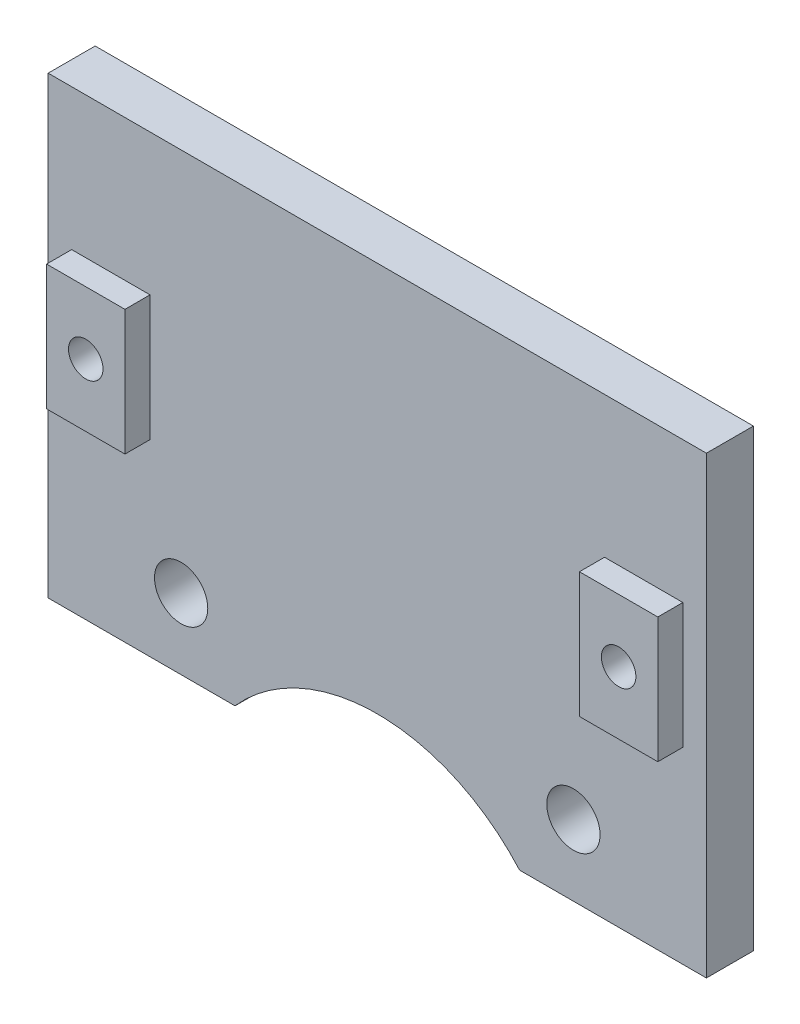
from build123d import *

# Parameters (mm, degrees)
MOUNTING_PLATE_SKETCH_W        = 42
MOUNTING_PLATE_SKETCH_H        = 29
MOUNTING_PLATE_DEPTH           = 3
AXLE_COLLAR_CLEARANCE_SKETCH_R = 12.1
AXLE_COLLAR_CLEARANCE_DEPTH    = 3.2
M3_CAP_BOLT_HOLE_1_SKETCH_R    = 1.7
M3_CAP_BOLT_HOLE_1_DEPTH       = 3.2
M3_CAP_BOLT_HOLE_2_SKETCH_R    = 1.7
M3_CAP_BOLT_HOLE_2_DEPTH       = 3.2
CLAMP_SEAT_1_SKETCH_W          = 5
CLAMP_SEAT_1_SKETCH_H          = 8
CLAMP_SEAT_1_DEPTH             = 1.7
M2_SCREW_CLEARANCE_1_SKETCH_R  = 1.1
M2_SCREW_CLEARANCE_1_DEPTH     = 4.8
M2_INSERT_POCKET_1_SKETCH_R    = 1.6
M2_INSERT_POCKET_1_DEPTH       = 2.5
CLAMP_SEAT_2_SKETCH_W          = 5
CLAMP_SEAT_2_SKETCH_H          = 8
CLAMP_SEAT_2_DEPTH             = 1.7
M2_SCREW_CLEARANCE_2_SKETCH_R  = 1.1
M2_SCREW_CLEARANCE_2_DEPTH     = 4.8
M2_INSERT_POCKET_2_SKETCH_R    = 1.6
M2_INSERT_POCKET_2_DEPTH       = 2.5


with BuildPart() as part:
    # Mounting Plate Sketch → Mounting Plate (new body)
    with BuildSketch(Plane.XY):
        with Locations((0, -1.5)):
            Rectangle(MOUNTING_PLATE_SKETCH_W, MOUNTING_PLATE_SKETCH_H)
    extrude(amount=MOUNTING_PLATE_DEPTH)

    # Axle Collar Clearance Sketch → Axle Collar Clearance (cut)
    with BuildSketch(Plane.XY.offset(-0.1)):
        with Locations((0, -24)):
            Circle(AXLE_COLLAR_CLEARANCE_SKETCH_R)
    extrude(amount=AXLE_COLLAR_CLEARANCE_DEPTH, mode=Mode.SUBTRACT)

    # M3 Cap Bolt Hole 1 Sketch → M3 Cap Bolt Hole 1 (cut)
    with BuildSketch(Plane.XY.offset(-0.1)):
        with Locations((-12.515790027, -11.484209973)):
            Circle(M3_CAP_BOLT_HOLE_1_SKETCH_R)
    extrude(amount=M3_CAP_BOLT_HOLE_1_DEPTH, mode=Mode.SUBTRACT)

    # M3 Cap Bolt Hole 2 Sketch → M3 Cap Bolt Hole 2 (cut)
    with BuildSketch(Plane.XY.offset(-0.1)):
        with Locations((12.515790027, -11.484209973)):
            Circle(M3_CAP_BOLT_HOLE_2_SKETCH_R)
    extrude(amount=M3_CAP_BOLT_HOLE_2_DEPTH, mode=Mode.SUBTRACT)

    # Clamp Seat 1 Sketch → Clamp Seat 1 (add)
    with BuildSketch(Plane.XY.offset(2.9)):
        with Locations((-17, 0)):
            Rectangle(CLAMP_SEAT_1_SKETCH_W, CLAMP_SEAT_1_SKETCH_H)
    extrude(amount=CLAMP_SEAT_1_DEPTH)

    # M2 Screw Clearance 1 Sketch → M2 Screw Clearance 1 (cut)
    with BuildSketch(Plane.XY.offset(-0.1)):
        with Locations((-17, 0)):
            Circle(M2_SCREW_CLEARANCE_1_SKETCH_R)
    extrude(amount=M2_SCREW_CLEARANCE_1_DEPTH, mode=Mode.SUBTRACT)

    # M2 Insert Pocket 1 Sketch → M2 Insert Pocket 1 (cut)
    with BuildSketch(Plane.XY.offset(-0.1)):
        with Locations((-17, 0)):
            Circle(M2_INSERT_POCKET_1_SKETCH_R)
    extrude(amount=M2_INSERT_POCKET_1_DEPTH, mode=Mode.SUBTRACT)

    # Clamp Seat 2 Sketch → Clamp Seat 2 (add)
    with BuildSketch(Plane.XY.offset(2.9)):
        with Locations((17, 0)):
            Rectangle(CLAMP_SEAT_2_SKETCH_W, CLAMP_SEAT_2_SKETCH_H)
    extrude(amount=CLAMP_SEAT_2_DEPTH)

    # M2 Screw Clearance 2 Sketch → M2 Screw Clearance 2 (cut)
    with BuildSketch(Plane.XY.offset(-0.1)):
        with Locations((17, 0)):
            Circle(M2_SCREW_CLEARANCE_2_SKETCH_R)
    extrude(amount=M2_SCREW_CLEARANCE_2_DEPTH, mode=Mode.SUBTRACT)

    # M2 Insert Pocket 2 Sketch → M2 Insert Pocket 2 (cut)
    with BuildSketch(Plane.XY.offset(-0.1)):
        with Locations((17, 0)):
            Circle(M2_INSERT_POCKET_2_SKETCH_R)
    extrude(amount=M2_INSERT_POCKET_2_DEPTH, mode=Mode.SUBTRACT)


solid = part.part
